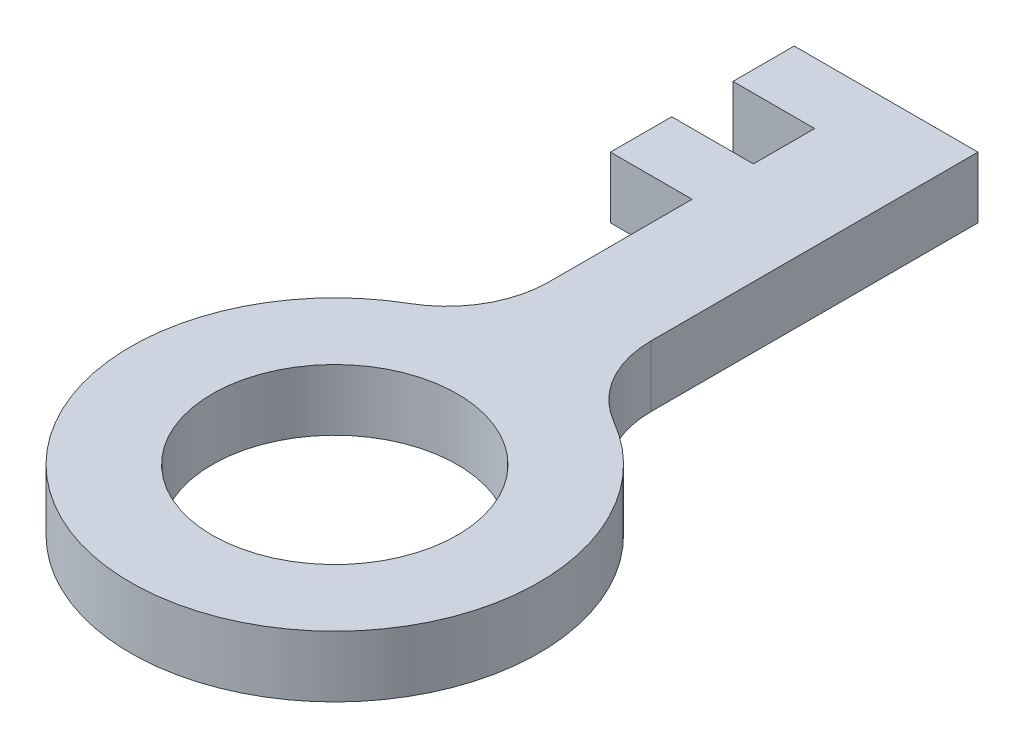
from build123d import *

# Parameters (mm, degrees)
SKETCH1_R           = 10
BOSS_EXTRUDE1_DEPTH = 3
SKETCH2_W           = 5
SKETCH2_H           = 20
BOSS_EXTRUDE2_DEPTH = 3
SKETCH3_W           = 3
SKETCH3_H           = 3
BOSS_EXTRUDE3_DEPTH = 4
SKETCH4_R           = 6
CUT_EXTRUDE1_DEPTH  = 3
FILLET1_R           = 5


with BuildPart() as part:
    # Sketch1 → Boss-Extrude1 (new body)
    with BuildSketch(Plane(origin=(0, 0, 0), x_dir=(1, 0, 0), z_dir=(0, 1, 0))):
        with Locations(Location((0, 0, 0), (0, 0, 270))):
            Circle(SKETCH1_R)
    extrude(amount=BOSS_EXTRUDE1_DEPTH)

    # Sketch2 → Boss-Extrude2 (add)
    with BuildSketch(Plane(origin=(0, 3, 0), x_dir=(1, 0, 0), z_dir=(0, 1, 0))):
        with Locations((0, 19)):
            Rectangle(SKETCH2_W, SKETCH2_H)
    extrude(amount=-BOSS_EXTRUDE2_DEPTH)

    # Sketch3 → Boss-Extrude3 (add)
    with BuildSketch(Plane.ZY.offset(2.5)):
        with Locations((-27.5, 1.5)):
            Rectangle(SKETCH3_W, SKETCH3_H)
        with Locations((-21.5, 1.5)):
            Rectangle(SKETCH3_W, SKETCH3_H)
    extrude(amount=BOSS_EXTRUDE3_DEPTH)

    # Sketch4 → Cut-Extrude1 (cut)
    with BuildSketch(Plane(origin=(0, 3, 0), x_dir=(1, 0, 0), z_dir=(0, 1, 0))):
        with Locations(Location((0, 0, 0), (0, 0, 270))):
            Circle(SKETCH4_R)
    extrude(amount=-CUT_EXTRUDE1_DEPTH, mode=Mode.SUBTRACT)

    # Fillet1
    fillet1_edges = [part.edges().sort_by_distance(p)[0] for p in [
        (-2.5, 1.5, -9.682458366),
        (2.5, 1.5, -9.682458366),
    ]]
    fillet(fillet1_edges, radius=FILLET1_R)


solid = part.part
